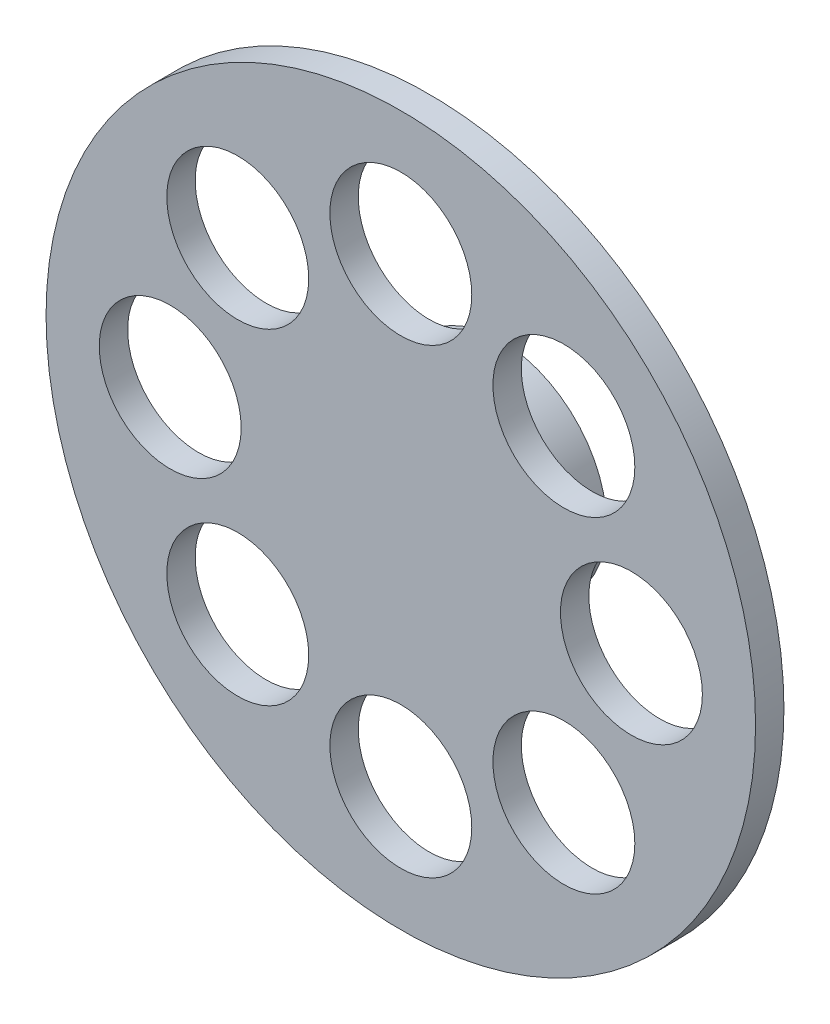
from build123d import *

# Parameters (mm, degrees)
ESBO_O1_R                = 7.5
ESBO_O1_R_2              = 4.9
RESSALTO_EXTRUS_O1_DEPTH = 5
CORTE_EXTRUS_O1_DEPTH    = 5
PADR_OCIRCULAR2_COUNT    = 14
ESBO_O2_R                = 25
ESBO_O2_R_2              = 5
RESSALTO_EXTRUS_O2_DEPTH = 2


with BuildPart() as part:
    # Esboço1 → Ressalto-extrusão1 (new body)
    with BuildSketch(Plane.XY):
        Circle(ESBO_O1_R)
        Circle(ESBO_O1_R_2, mode=Mode.SUBTRACT)
    extrude(amount=RESSALTO_EXTRUS_O1_DEPTH)

    # Esboço1<3> → Corte-extrusão1 (cut)
    with BuildSketch(Plane.XY):
        with BuildLine():
            Line((0.9, 4.816637832), (0.89, 6.438780941))
            ThreePointArc((0.89, 6.438780941), (0, 6.5), (-0.89, 6.438780941))
            Line((-0.89, 6.438780941), (-0.9, 4.816637832))
            ThreePointArc((-0.9, 4.816637832), (0, 4.9), (0.9, 4.816637832))
        make_face()
    corte_extrus_o1 = extrude(amount=CORTE_EXTRUS_O1_DEPTH, mode=Mode.SUBTRACT)

    # PadrãoCircular2: Corte-extrusão1 ×14 about axis
    padr_ocircular2_axis = Axis((0, 0, 5), (0, 0, -1))
    for i in range(1, PADR_OCIRCULAR2_COUNT):
        add(corte_extrus_o1.rotate(padr_ocircular2_axis, i * 360 / PADR_OCIRCULAR2_COUNT), mode=Mode.SUBTRACT)

    # Esboço2 → Ressalto-extrusão2 (add)
    with BuildSketch(Plane.XY.offset(5)):
        Circle(ESBO_O2_R)
        with Locations((0, 16.25)):
            Circle(ESBO_O2_R_2, mode=Mode.SUBTRACT)
        with Locations((11.490485194, 11.490485194)):
            Circle(ESBO_O2_R_2, mode=Mode.SUBTRACT)
        with Locations((16.25, 0)):
            Circle(ESBO_O2_R_2, mode=Mode.SUBTRACT)
        with Locations((11.490485194, -11.490485194)):
            Circle(ESBO_O2_R_2, mode=Mode.SUBTRACT)
        with Locations((0, -16.25)):
            Circle(ESBO_O2_R_2, mode=Mode.SUBTRACT)
        with Locations((-11.490485194, -11.490485194)):
            Circle(ESBO_O2_R_2, mode=Mode.SUBTRACT)
        with Locations((-16.25, 0)):
            Circle(ESBO_O2_R_2, mode=Mode.SUBTRACT)
        with Locations((-11.490485194, 11.490485194)):
            Circle(ESBO_O2_R_2, mode=Mode.SUBTRACT)
    extrude(amount=RESSALTO_EXTRUS_O2_DEPTH)


solid = part.part
